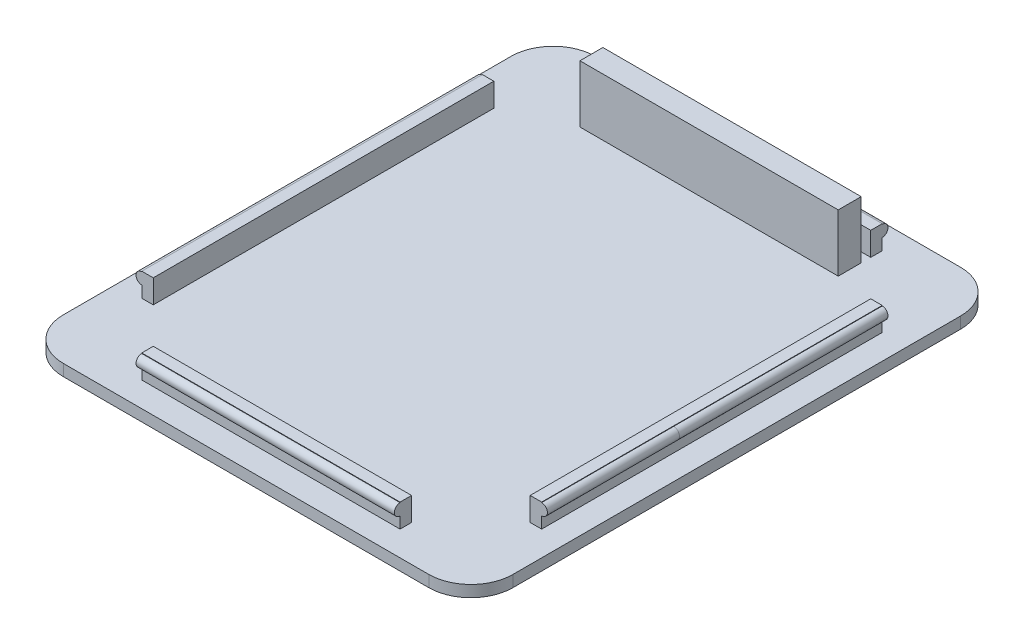
from build123d import *

# Parameters (mm, degrees)
BOSS_EXTRUDE5_DEPTH = 0.6
BOSS_EXTRUDE6_DEPTH = 1.225
SKETCH15_R          = 0.3
SKETCH17_W          = 5
SKETCH17_H          = 5
CUT_EXTRUDE1_DEPTH  = 10
SKETCH18_W          = 13.5
SKETCH18_H          = 1.2
BOSS_EXTRUDE7_DEPTH = 3


with BuildPart() as part:
    # Sketch1 → Boss-Extrude5 (new body)
    with BuildSketch(Plane(origin=(0, 0, 0), x_dir=(1, 0, 0), z_dir=(0, 1, 0))):
        with BuildLine():
            Line((0.8, 26.4), (19.9, 26.4))
            ThreePointArc((19.9, 26.4), (21.455634919, 25.755634919), (22.1, 24.2))
            Line((22.1, 24.2), (22.1, 0.8))
            ThreePointArc((22.1, 0.8), (21.455634919, -0.755634919), (19.9, -1.4))
            Line((19.9, -1.4), (0.8, -1.4))
            ThreePointArc((0.8, -1.4), (-0.755634919, -0.755634919), (-1.4, 0.8))
            Line((-1.4, 0.8), (-1.4, 24.2))
            ThreePointArc((-1.4, 24.2), (-0.755634919, 25.755634919), (0.8, 26.4))
        make_face()
    extrude(amount=BOSS_EXTRUDE5_DEPTH)

    # Sketch13 → Boss-Extrude6 (add)
    with BuildSketch(Plane(origin=(0, 0.6, 0), x_dir=(1, 0, 0), z_dir=(0, 1, 0))):
        with BuildLine():
            Line((-0.1, 24.2), (-0.1, 0.8))
            ThreePointArc((-0.1, 0.8), (0.163603897, 0.163603897), (0.8, -0.1))
            Line((0.8, -0.1), (19.9, -0.1))
            ThreePointArc((19.9, -0.1), (20.536396103, 0.163603897), (20.8, 0.8))
            Line((20.8, 0.8), (20.8, 24.2))
            ThreePointArc((20.8, 24.2), (20.536396103, 24.836396103), (19.9, 25.1))
            Line((19.9, 25.1), (0.8, 25.1))
            ThreePointArc((0.8, 25.1), (0.163603897, 24.836396103), (-0.1, 24.2))
        make_face()
        with BuildLine():
            Line((19.9, 24.5), (0.8, 24.5))
            ThreePointArc((0.8, 24.5), (0.587867966, 24.412132034), (0.5, 24.2))
            Line((0.5, 24.2), (0.5, 0.8))
            ThreePointArc((0.5, 0.8), (0.587867966, 0.587867966), (0.8, 0.5))
            Line((0.8, 0.5), (19.9, 0.5))
            ThreePointArc((19.9, 0.5), (20.112132034, 0.587867966), (20.2, 0.8))
            Line((20.2, 0.8), (20.2, 24.2))
            ThreePointArc((20.2, 24.2), (20.112132034, 24.412132034), (19.9, 24.5))
        make_face(mode=Mode.SUBTRACT)
    extrude(amount=BOSS_EXTRUDE6_DEPTH)

    # Sweep1: sweep along a path in Sketch16
    with BuildLine(Plane(origin=(0, 1.825, 0), x_dir=(1, 0, 0), z_dir=(0, 1, 0))) as sweep1_path:
        Line((-0.1, 24.2), (-0.1, 0.8))
        ThreePointArc((-0.1, 0.8), (0.163603897, 0.163603897), (0.8, -0.1))
        Line((0.8, -0.1), (19.9, -0.1))
        ThreePointArc((19.9, -0.1), (20.536396103, 0.163603897), (20.8, 0.8))
        Line((20.8, 0.8), (20.8, 24.2))
        ThreePointArc((20.8, 24.2), (20.536396103, 24.836396103), (19.9, 25.1))
        Line((19.9, 25.1), (0.8, 25.1))
        ThreePointArc((0.8, 25.1), (0.163603897, 24.836396103), (-0.1, 24.2))
    # Sketch15 → Sweep1 (sweep)
    with BuildSketch(Plane(origin=(0, 0, -10.5), x_dir=(-1, 0, 0), z_dir=(0, 0, -1))):
        with Locations((-20.8, 1.5)):
            Circle(SKETCH15_R)
    sweep(path=sweep1_path.line)

    # Sketch17 → Cut-Extrude1 (cut)
    with BuildSketch(Plane(origin=(0, 0.6, 0), x_dir=(1, 0, 0), z_dir=(0, 1, 0))):
        with Locations((1.1, 23.9)):
            Rectangle(SKETCH17_W, SKETCH17_H)
        with Locations((19.6, 23.9)):
            Rectangle(SKETCH17_W, SKETCH17_H)
        with Locations((19.6, 1.1)):
            Rectangle(SKETCH17_W, SKETCH17_H)
        with Locations((1.1, 1.1)):
            Rectangle(SKETCH17_W, SKETCH17_H)
    extrude(amount=CUT_EXTRUDE1_DEPTH, mode=Mode.SUBTRACT)

    # Sketch18 → Boss-Extrude7 (add)
    with BuildSketch(Plane(origin=(0, 0.6, 0), x_dir=(1, 0, 0), z_dir=(0, 1, 0))):
        with Locations((10.35, 23.4)):
            Rectangle(SKETCH18_W, SKETCH18_H)
    extrude(amount=BOSS_EXTRUDE7_DEPTH)


solid = part.part
